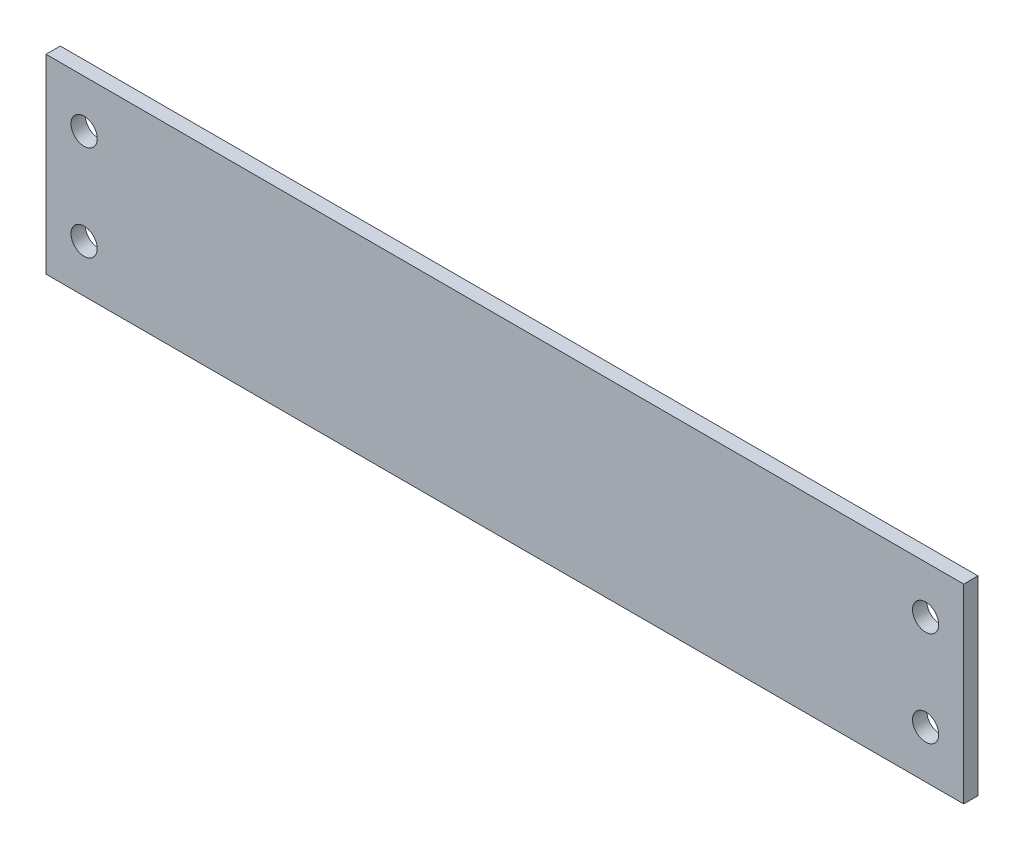
from build123d import *

# Parameters (mm, degrees)
EXTRUSION_BASE_SKETCH_W      = 192.75
EXTRUSION_BASE_SKETCH_H      = 40
EXTRUSION_BASE_EXTRUDE_DEPTH = 3
M5_MOUNTING_HOLES_D          = 5.5


with BuildPart() as part:
    # Extrusion Base Sketch → Extrusion Base Extrude (new body)
    with BuildSketch(Plane.XY):
        with Locations((-96.375, 20)):
            Rectangle(EXTRUSION_BASE_SKETCH_W, EXTRUSION_BASE_SKETCH_H)
    extrude(amount=EXTRUSION_BASE_EXTRUDE_DEPTH)

    # M5 Mounting Holes (through all)
    with Locations(Plane.XY.offset(3)):
        with Locations((-8, 30), (-8, 10), (-184.75, 30), (-184.75, 10)):
            Hole(M5_MOUNTING_HOLES_D / 2)


solid = part.part
